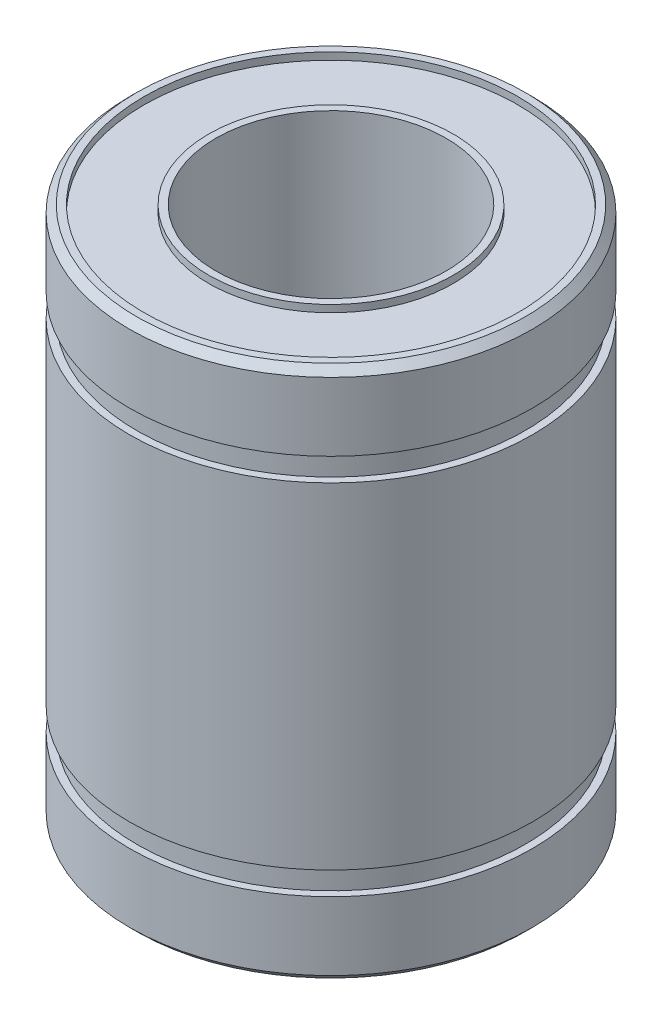
from build123d import *

# Parameters (mm, degrees)
SKETCH2_R          = 13
SKETCH2_R_2        = 8.5
CUT_EXTRUDE1_DEPTH = 0.5


with BuildPart() as part:
    # Sketch1 → Revolve1 (revolve)
    with BuildSketch(Plane.XY, mode=Mode.PRIVATE) as revolve1_sk:
        Polygon((8, -18.5), (8, 18.5), (13.5, 18.5), (14, 18), (14, 13.25), (13.5, 13.25), (13.5, 11.65), (14, 11.65), (14, -11.65), (13.5, -11.65), (13.5, -13.25), (14, -13.25), (14, -18), (13.5, -18.5), align=None)
    revolve(revolve1_sk.sketch.rotate(Axis((0, 18.5, 0), (0, -1, 0)), 180), axis=Axis((0, 18.5, 0), (0, -1, 0)))

    # Sketch2 → Cut-Extrude1 (cut)
    with BuildSketch(Plane(origin=(0, 18.5, 0), x_dir=(1, 0, 0), z_dir=(0, 1, 0))):
        with Locations(Location((0, 0, 0), (0, 0, 180))):
            Circle(SKETCH2_R)
        with Locations(Location((0, 0, 0), (0, 0, 180))):
            Circle(SKETCH2_R_2, mode=Mode.SUBTRACT)
    cut_extrude1 = extrude(amount=-CUT_EXTRUDE1_DEPTH, mode=Mode.SUBTRACT)

    # Mirror1: Cut-Extrude1 across plane
    add(cut_extrude1.mirror(Plane.ZX), mode=Mode.SUBTRACT)


solid = part.part
